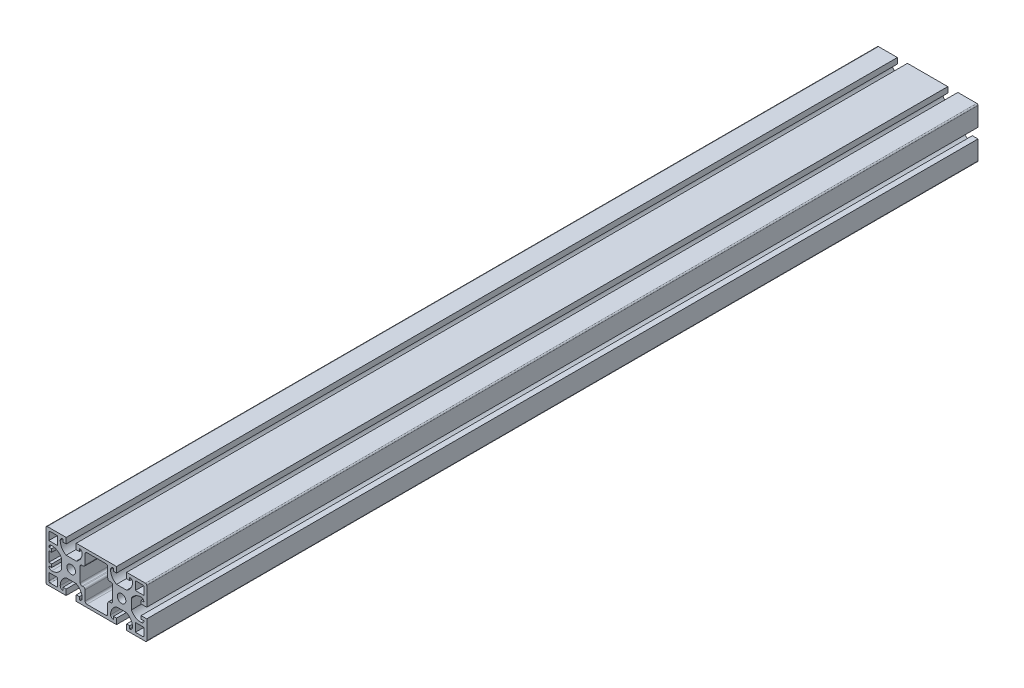
from build123d import *

# Parameters (mm, degrees)
SZKIC1_R                    = 3.4
DODANIE_WYCI_GNI_CIE1_DEPTH = 660


with BuildPart() as part:
    # Szkic1 → Dodanie-wyciągnięcie1 (new body)
    with BuildSketch(Plane.XY):
        with BuildLine():
            Line((-40, -19), (-40, 19))
            ThreePointArc((-40, 19), (-39.707106781, 19.707106781), (-39, 20))
            Line((-39, 20), (-24, 20))
            Line((-24, 20), (-24, 15.5))
            Line((-24, 15.5), (-26.471381771, 15.5))
            Line((-26.471381771, 15.5), (-26.471381771, 17.75))
            ThreePointArc((-26.471381771, 17.75), (-28.062372029, 17.090990258), (-28.721381771, 15.5))
            ThreePointArc((-28.721381771, 15.5), (-27.448087912, 10.962546258), (-24, 7.75))
            Line((-24, 7.75), (-16, 7.75))
            ThreePointArc((-16, 7.75), (-12.551912088, 10.962546258), (-11.278618229, 15.5))
            ThreePointArc((-11.278618229, 15.5), (-11.937627971, 17.090990258), (-13.528618229, 17.75))
            Line((-13.528618229, 17.75), (-13.528618229, 15.5))
            Line((-13.528618229, 15.5), (-16, 15.5))
            Line((-16, 15.5), (-16, 20))
            Line((-16, 20), (13.528618229, 20))
            Line((13.528618229, 20), (16, 20))
            Line((16, 20), (16, 15.5))
            Line((16, 15.5), (13.528618229, 15.5))
            Line((13.528618229, 15.5), (13.528618229, 17.75))
            ThreePointArc((13.528618229, 17.75), (11.937627971, 17.090990258), (11.278618229, 15.5))
            ThreePointArc((11.278618229, 15.5), (12.551912088, 10.962546258), (16, 7.75))
            Line((16, 7.75), (24, 7.75))
            ThreePointArc((24, 7.75), (27.448087912, 10.962546258), (28.721381771, 15.5))
            ThreePointArc((28.721381771, 15.5), (28.062372029, 17.090990258), (26.471381771, 17.75))
            Line((26.471381771, 17.75), (26.471381771, 15.5))
            Line((26.471381771, 15.5), (24, 15.5))
            Line((24, 15.5), (24, 20))
            Line((24, 20), (39, 20))
            ThreePointArc((39, 20), (39.707106781, 19.707106781), (40, 19))
            Line((40, 19), (40, 4))
            Line((40, 4), (35.5, 4))
            Line((35.5, 4), (35.5, 6.471381771))
            Line((35.5, 6.471381771), (37.75, 6.471381771))
            ThreePointArc((37.75, 6.471381771), (37.090990258, 8.062372029), (35.5, 8.721381771))
            ThreePointArc((35.5, 8.721381771), (30.962546258, 7.448087912), (27.75, 4))
            Line((27.75, 4), (27.75, -4))
            ThreePointArc((27.75, -4), (30.962546258, -7.448087912), (35.5, -8.721381771))
            ThreePointArc((35.5, -8.721381771), (37.090990258, -8.062372029), (37.75, -6.471381771))
            Line((37.75, -6.471381771), (35.5, -6.471381771))
            Line((35.5, -6.471381771), (35.5, -4))
            Line((35.5, -4), (40, -4))
            Line((40, -4), (40, -19))
            ThreePointArc((40, -19), (39.707106781, -19.707106781), (39, -20))
            Line((39, -20), (24, -20))
            Line((24, -20), (24, -15.5))
            Line((24, -15.5), (26.471381771, -15.5))
            Line((26.471381771, -15.5), (26.471381771, -17.75))
            ThreePointArc((26.471381771, -17.75), (28.062372029, -17.090990258), (28.721381771, -15.5))
            ThreePointArc((28.721381771, -15.5), (27.448087912, -10.962546258), (24, -7.75))
            Line((24, -7.75), (16, -7.75))
            ThreePointArc((16, -7.75), (12.551912088, -10.962546258), (11.278618229, -15.5))
            ThreePointArc((11.278618229, -15.5), (11.937627971, -17.090990258), (13.528618229, -17.75))
            Line((13.528618229, -17.75), (13.528618229, -15.5))
            Line((13.528618229, -15.5), (16, -15.5))
            Line((16, -15.5), (16, -20))
            Line((16, -20), (-16, -20))
            Line((-16, -20), (-16, -15.5))
            Line((-16, -15.5), (-13.528618229, -15.5))
            Line((-13.528618229, -15.5), (-13.528618229, -17.75))
            ThreePointArc((-13.528618229, -17.75), (-11.937627971, -17.090990258), (-11.278618229, -15.5))
            ThreePointArc((-11.278618229, -15.5), (-12.551912088, -10.962546258), (-16, -7.75))
            Line((-16, -7.75), (-24, -7.75))
            ThreePointArc((-24, -7.75), (-27.448087912, -10.962546258), (-28.721381771, -15.5))
            ThreePointArc((-28.721381771, -15.5), (-28.062372029, -17.090990258), (-26.471381771, -17.75))
            Line((-26.471381771, -17.75), (-26.471381771, -15.5))
            Line((-26.471381771, -15.5), (-24, -15.5))
            Line((-24, -15.5), (-24, -20))
            Line((-24, -20), (-39, -20))
            ThreePointArc((-39, -20), (-39.707106781, -19.707106781), (-40, -19))
        make_face()
        with Locations((-20, 0)):
            Circle(SZKIC1_R, mode=Mode.SUBTRACT)
        with Locations((20, 0)):
            Circle(SZKIC1_R, mode=Mode.SUBTRACT)
        with BuildLine():
            Line((30.971381771, -17.75), (36.75, -17.75))
            ThreePointArc((36.75, -17.75), (37.457106781, -17.457106781), (37.75, -16.75))
            Line((37.75, -16.75), (37.75, -10.971381771))
            Line((37.75, -10.971381771), (30.971381771, -10.971381771))
            Line((30.971381771, -10.971381771), (30.971381771, -17.75))
        make_face(mode=Mode.SUBTRACT)
        with BuildLine():
            Line((-35.5, -6.471381771), (-37.75, -6.471381771))
            ThreePointArc((-37.75, -6.471381771), (-37.090990258, -8.062372029), (-35.5, -8.721381771))
            ThreePointArc((-35.5, -8.721381771), (-30.962546258, -7.448087912), (-27.75, -4))
            Line((-27.75, -4), (-27.75, 4))
            ThreePointArc((-27.75, 4), (-30.962546258, 7.448087912), (-35.5, 8.721381771))
            ThreePointArc((-35.5, 8.721381771), (-37.090990258, 8.062372029), (-37.75, 6.471381771))
            Line((-37.75, 6.471381771), (-35.5, 6.471381771))
            Line((-35.5, 6.471381771), (-35.5, 4))
            Line((-35.5, 4), (-37.75, 4))
            Line((-37.75, 4), (-37.75, -4))
            Line((-37.75, -4), (-35.5, -4))
            Line((-35.5, -4), (-35.5, -6.471381771))
        make_face(mode=Mode.SUBTRACT)
        with BuildLine():
            Line((10.528618229, 7.090188806), (11.40950808, 7.090188806))
            ThreePointArc((11.40950808, 7.090188806), (12.470168251, 6.650848977), (12.90950808, 5.590188806))
            Line((12.90950808, 5.590188806), (12.90950808, -5.590188806))
            ThreePointArc((12.90950808, -5.590188806), (12.470168251, -6.650848977), (11.40950808, -7.090188806))
            Line((11.40950808, -7.090188806), (10.528618229, -7.090188806))
            ThreePointArc((10.528618229, -7.090188806), (9.467958057, -7.529528634), (9.028618229, -8.590188806))
            Line((9.028618229, -8.590188806), (9.028618229, -16.25))
            ThreePointArc((9.028618229, -16.25), (8.589278401, -17.310660172), (7.528618229, -17.75))
            Line((7.528618229, -17.75), (-7.528618229, -17.75))
            ThreePointArc((-7.528618229, -17.75), (-8.589278401, -17.310660172), (-9.028618229, -16.25))
            Line((-9.028618229, -16.25), (-9.028618229, -8.590188806))
            ThreePointArc((-9.028618229, -8.590188806), (-9.467958057, -7.529528634), (-10.528618229, -7.090188806))
            Line((-10.528618229, -7.090188806), (-11.40950808, -7.090188806))
            ThreePointArc((-11.40950808, -7.090188806), (-12.470168251, -6.650848977), (-12.90950808, -5.590188806))
            Line((-12.90950808, -5.590188806), (-12.90950808, 5.590188806))
            ThreePointArc((-12.90950808, 5.590188806), (-12.470168251, 6.650848977), (-11.40950808, 7.090188806))
            Line((-11.40950808, 7.090188806), (-10.528618229, 7.090188806))
            ThreePointArc((-10.528618229, 7.090188806), (-9.467958057, 7.529528634), (-9.028618229, 8.590188806))
            Line((-9.028618229, 8.590188806), (-9.028618229, 16.25))
            ThreePointArc((-9.028618229, 16.25), (-8.589278401, 17.310660172), (-7.528618229, 17.75))
            Line((-7.528618229, 17.75), (7.528618229, 17.75))
            ThreePointArc((7.528618229, 17.75), (8.589278401, 17.310660172), (9.028618229, 16.25))
            Line((9.028618229, 16.25), (9.028618229, 8.590188806))
            ThreePointArc((9.028618229, 8.590188806), (9.467958057, 7.529528634), (10.528618229, 7.090188806))
        make_face(mode=Mode.SUBTRACT)
        with BuildLine():
            Line((30.971381771, 10.971381771), (37.75, 10.971381771))
            Line((37.75, 10.971381771), (37.75, 16.75))
            ThreePointArc((37.75, 16.75), (37.457106781, 17.457106781), (36.75, 17.75))
            Line((36.75, 17.75), (30.971381771, 17.75))
            Line((30.971381771, 17.75), (30.971381771, 10.971381771))
        make_face(mode=Mode.SUBTRACT)
        with BuildLine():
            Line((-30.971381771, -10.971381771), (-30.971381771, -17.75))
            Line((-30.971381771, -17.75), (-36.75, -17.75))
            ThreePointArc((-36.75, -17.75), (-37.457106781, -17.457106781), (-37.75, -16.75))
            Line((-37.75, -16.75), (-37.75, -10.971381771))
            Line((-37.75, -10.971381771), (-30.971381771, -10.971381771))
        make_face(mode=Mode.SUBTRACT)
        with BuildLine():
            Line((-30.971381771, 17.75), (-36.75, 17.75))
            ThreePointArc((-36.75, 17.75), (-37.457106781, 17.457106781), (-37.75, 16.75))
            Line((-37.75, 16.75), (-37.75, 10.971381771))
            Line((-37.75, 10.971381771), (-30.971381771, 10.971381771))
            Line((-30.971381771, 10.971381771), (-30.971381771, 17.75))
        make_face(mode=Mode.SUBTRACT)
    extrude(amount=DODANIE_WYCI_GNI_CIE1_DEPTH)


solid = part.part
